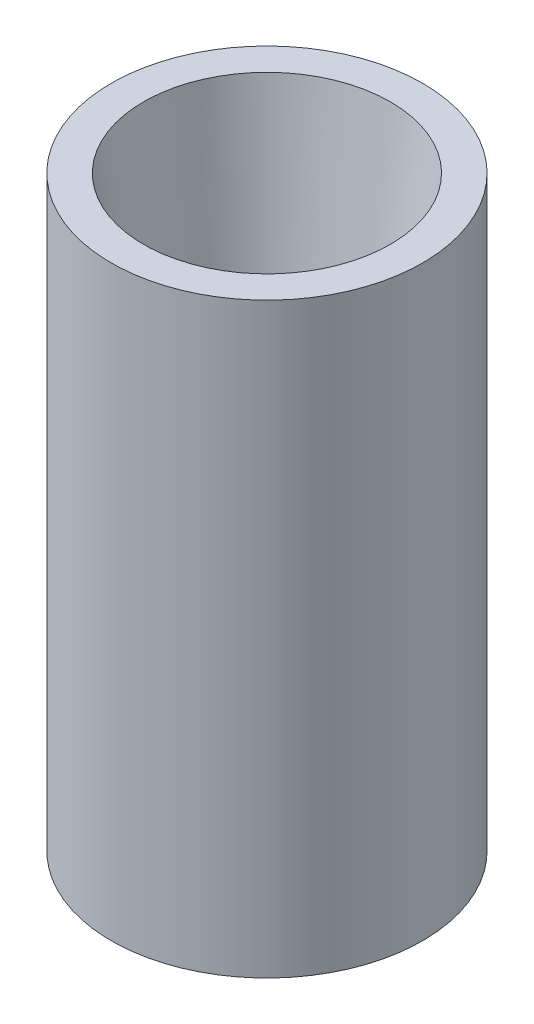
from build123d import *


with BuildPart() as part:
    # Sketch1 → Revolve1 (revolve)
    with BuildSketch(Plane.XY, mode=Mode.PRIVATE) as revolve1_sk:
        Polygon((-43.5, -7), (-43.5, 157.04410811), (-34.5, 157.04410811), (-20.5, 55), (-20.5, 5), (0, 5), (0, 2), (-18.034, 2), (-18.034, -7), align=None)
    revolve(revolve1_sk.sketch.rotate(Axis((0, 0, 0), (0, 1, 0)), 270), axis=Axis((0, 0, 0), (0, 1, 0)))


solid = part.part
